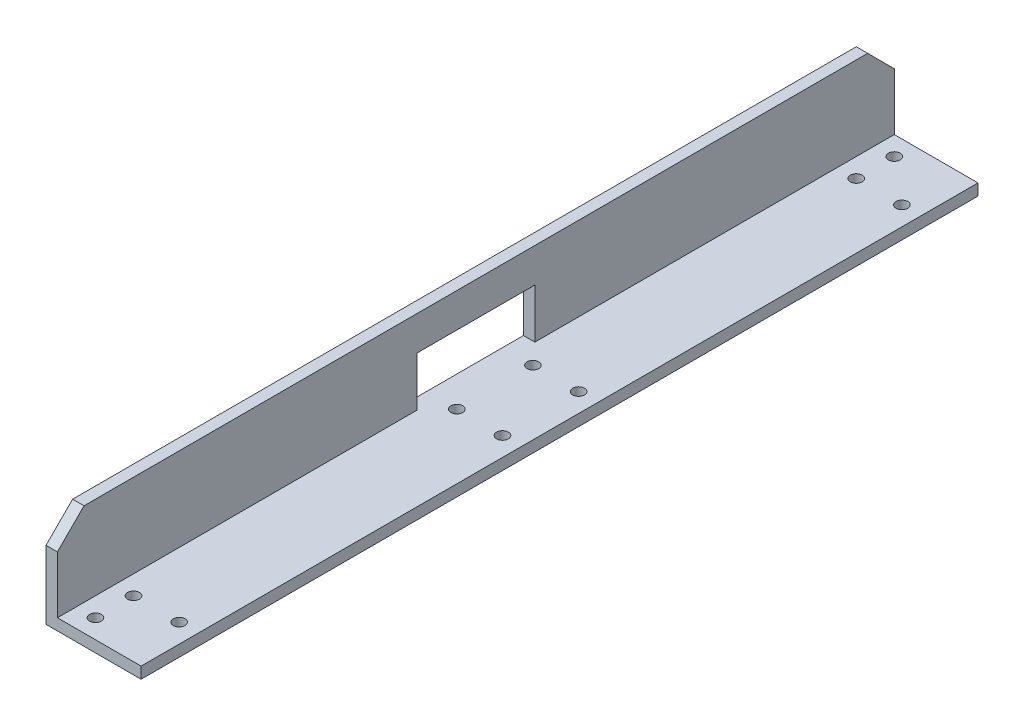
from build123d import *

# Parameters (mm, degrees)
BOSS_EXTRUDE1_DEPTH = 220
SKETCH2_W           = 31
SKETCH2_H           = 13
CUT_EXTRUDE1_DEPTH  = 10
SKETCH3_R           = 1.55
CUT_EXTRUDE2_DEPTH  = 220
CHAMFER1_SIZE       = 7


with BuildPart() as part:
    # Sketch1 → Boss-Extrude1 (new body)
    with BuildSketch(Plane.XY):
        Polygon((0, 0), (0, 25), (3, 25), (3, 3), (25, 3), (25, 0), align=None)
    extrude(amount=BOSS_EXTRUDE1_DEPTH)

    # Sketch2 → Cut-Extrude1 (cut)
    with BuildSketch(Plane(origin=(3, 0, 0), x_dir=(0, 0, -1), z_dir=(1, 0, 0))):
        with Locations((-110, 9.5)):
            Rectangle(SKETCH2_W, SKETCH2_H)
    extrude(amount=-CUT_EXTRUDE1_DEPTH, mode=Mode.SUBTRACT)

    # Sketch3 → Cut-Extrude2 (cut)
    with BuildSketch(Plane.XZ):
        with Locations((8, 100)):
            Circle(SKETCH3_R)
        with Locations((8, 120)):
            Circle(SKETCH3_R)
        with Locations((8, 215)):
            Circle(SKETCH3_R)
        with Locations((8, 205)):
            Circle(SKETCH3_R)
        with Locations((8, 15)):
            Circle(SKETCH3_R)
        with Locations((8, 5)):
            Circle(SKETCH3_R)
        with Locations((20, 120)):
            Circle(SKETCH3_R)
        with Locations((20, 100)):
            Circle(SKETCH3_R)
        with Locations((20, 15)):
            Circle(SKETCH3_R)
        with Locations((20, 205)):
            Circle(SKETCH3_R)
    extrude(amount=-CUT_EXTRUDE2_DEPTH, mode=Mode.SUBTRACT)

    # Chamfer1
    chamfer1_edges = [part.edges().sort_by_distance(p)[0] for p in [
        (1.5, 25, 220),
        (1.5, 25, 0),
    ]]
    chamfer(chamfer1_edges, length=CHAMFER1_SIZE)


solid = part.part
